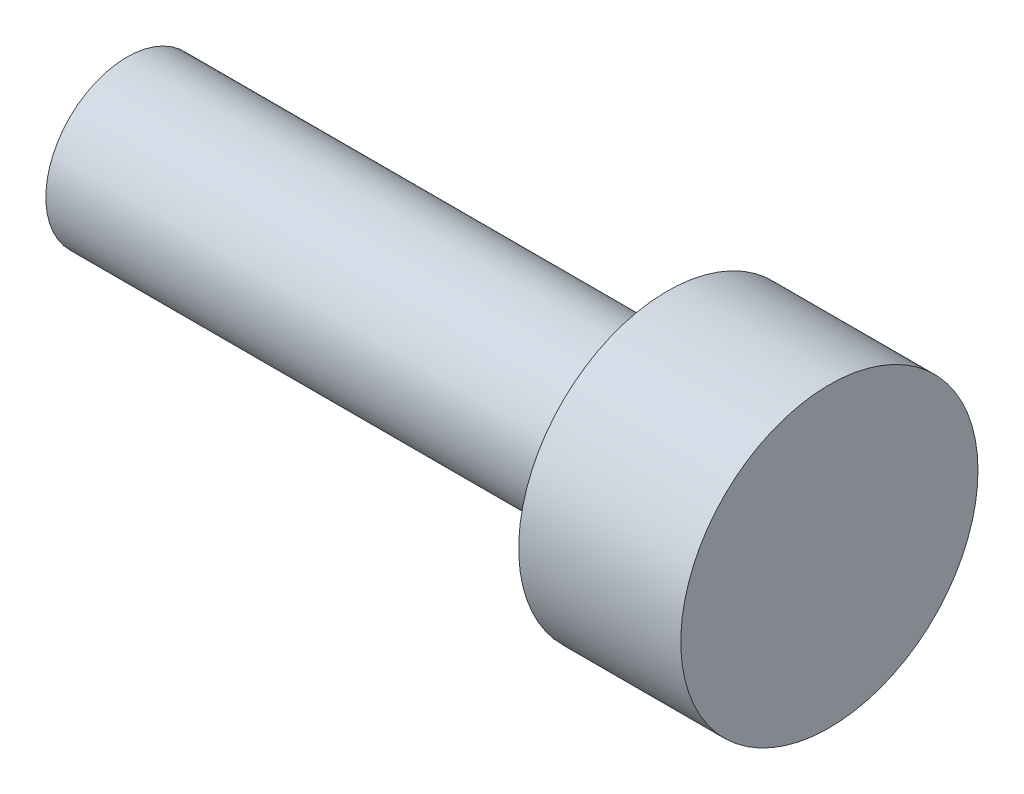
from build123d import *

# Parameters (mm, degrees)
HEAD_START  = 3
SKETCH1_R   = 2.75
HEAD_DEPTH  = 3
SHANK_START = -7
SKETCH2_R   = 1.5
SHANK_DEPTH = 10


with BuildPart() as part:
    # Sketch1 → head (new body)
    with BuildSketch(Plane(origin=(0, 0, 0), x_dir=(0, 0, -1), z_dir=(1, 0, 0)).offset(HEAD_START)):
        Circle(SKETCH1_R)
    extrude(amount=HEAD_DEPTH)


with BuildPart() as body_2:
    # Sketch2 → shank (new body)
    with BuildSketch(Plane(origin=(0, 0, 0), x_dir=(0, 0, -1), z_dir=(1, 0, 0)).offset(SHANK_START)):
        Circle(SKETCH2_R)
    extrude(amount=SHANK_DEPTH)


solid = Compound([part.part, body_2.part])
